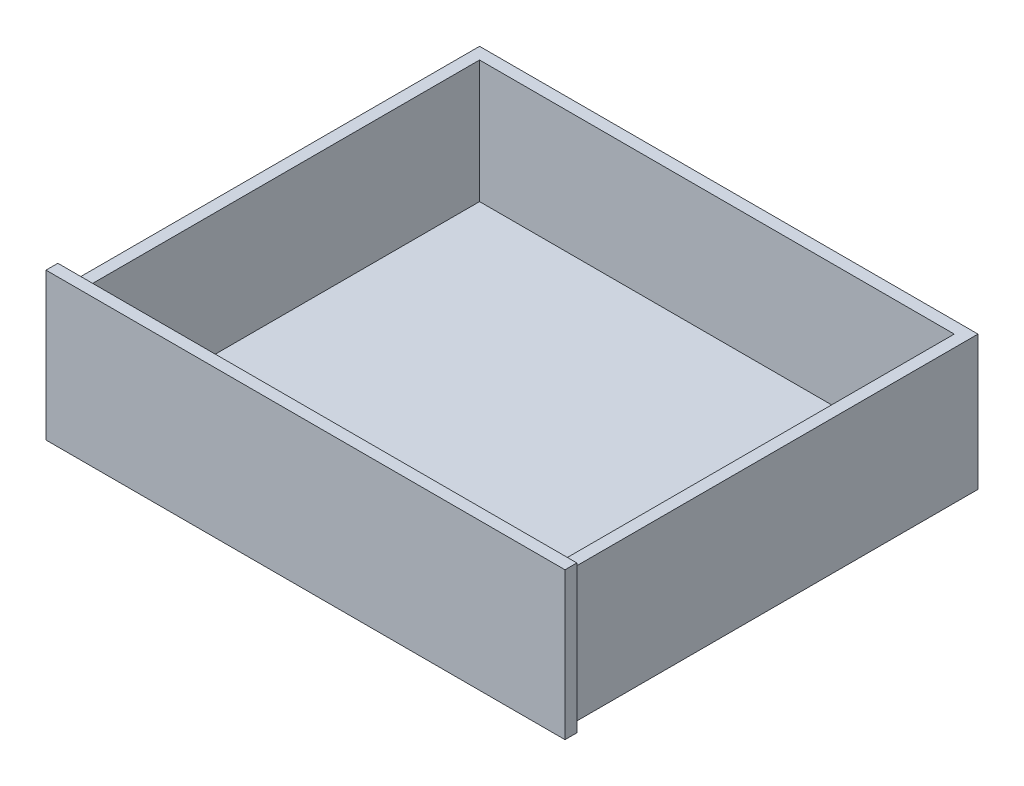
from build123d import *

# Parameters (mm, degrees)
SKETCH1_W           = 630
SKETCH1_H           = 520
EXTRUSION_DEPTH     = 170
DRAWER_S_INTERIOR_T = -15
SKETCH3_W           = 656
SKETCH3_H           = 186
BOSS_EXTRUDE3_DEPTH = 15


with BuildPart() as part:
    # Sketch1 → Extrusion (new body)
    with BuildSketch(Plane(origin=(0, 0, 0), x_dir=(1, 0, 0), z_dir=(0, 1, 0))):
        Rectangle(SKETCH1_W, SKETCH1_H)
    extrude(amount=EXTRUSION_DEPTH)

    # Drawer's interior
    drawer_s_interior_openings = [part.faces().sort_by_distance(p)[0] for p in [
        (0, 170, 0),
    ]]
    offset(amount=DRAWER_S_INTERIOR_T, openings=drawer_s_interior_openings, kind=Kind.INTERSECTION)

    # Sketch3 → Boss-Extrude3 (add)
    with BuildSketch(Plane.XY.offset(260)):
        with Locations((0, 93)):
            Rectangle(SKETCH3_W, SKETCH3_H)
    extrude(amount=BOSS_EXTRUDE3_DEPTH)


solid = part.part
